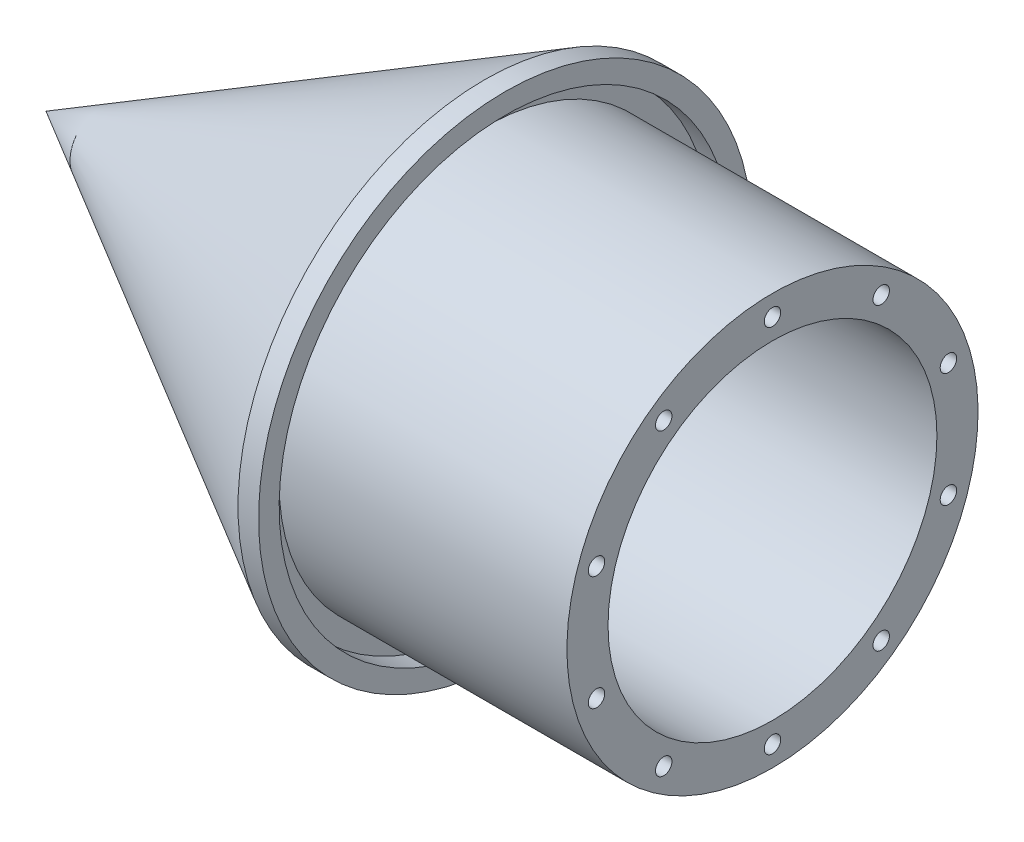
from build123d import *

# Parameters (mm, degrees)
SKETCH2_R          = 2
CUT_EXTRUDE1_DEPTH = 20
CIRPATTERN1_COUNT  = 10


with BuildPart() as part:
    # Sketch1 → Revolve2 (revolve)
    with BuildSketch(Plane.XY, mode=Mode.PRIVATE) as revolve2_sk:
        Polygon((-65, 60), (-70, 60), (-176.700455888, 0), (-160, 0), (-80, 45), (-80, 40), (0, 40), (0, 50), (-70, 50), (-70, 55), (-65, 55), align=None)
    revolve(revolve2_sk.sketch.rotate(Axis((-123.889506721, 0, 0), (1, 0, 0)), 180), axis=Axis((-123.889506721, 0, 0), (1, 0, 0)))

    # Sketch2 → Cut-Extrude1 (cut)
    with BuildSketch(Plane(origin=(0, 0, 0), x_dir=(0, 0, -1), z_dir=(1, 0, 0))):
        with Locations(Location((0, 45, 0), (0, 0, 90))):
            Circle(SKETCH2_R)
    cut_extrude1 = extrude(amount=-CUT_EXTRUDE1_DEPTH, mode=Mode.SUBTRACT)

    # CirPattern1: Cut-Extrude1 ×10 about axis
    cirpattern1_axis = Axis((0, 0, 0), (1, 0, 0))
    for i in range(1, CIRPATTERN1_COUNT):
        add(cut_extrude1.rotate(cirpattern1_axis, i * 360 / CIRPATTERN1_COUNT), mode=Mode.SUBTRACT)


solid = part.part
